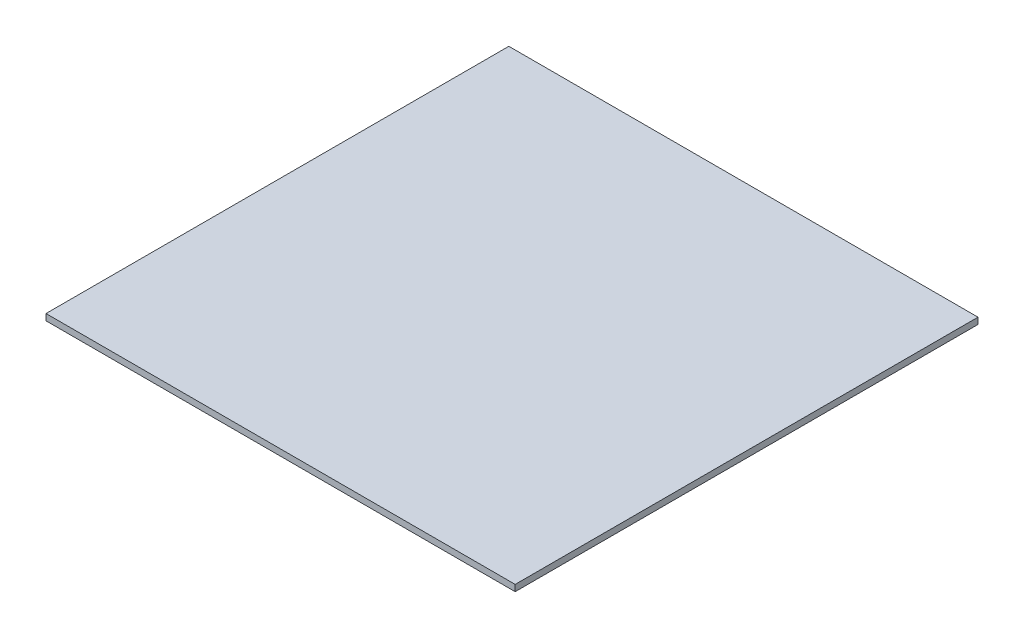
from build123d import *

# Parameters (mm, degrees)
SKETCH1_W           = 74
SKETCH1_H           = 73
BOSS_EXTRUDE1_DEPTH = 1


with BuildPart() as part:
    # Sketch1 → Boss-Extrude1 (new body)
    with BuildSketch(Plane(origin=(0, 0, 0), x_dir=(1, 0, 0), z_dir=(0, 1, 0))):
        Rectangle(SKETCH1_W, SKETCH1_H)
    extrude(amount=BOSS_EXTRUDE1_DEPTH)


solid = part.part
